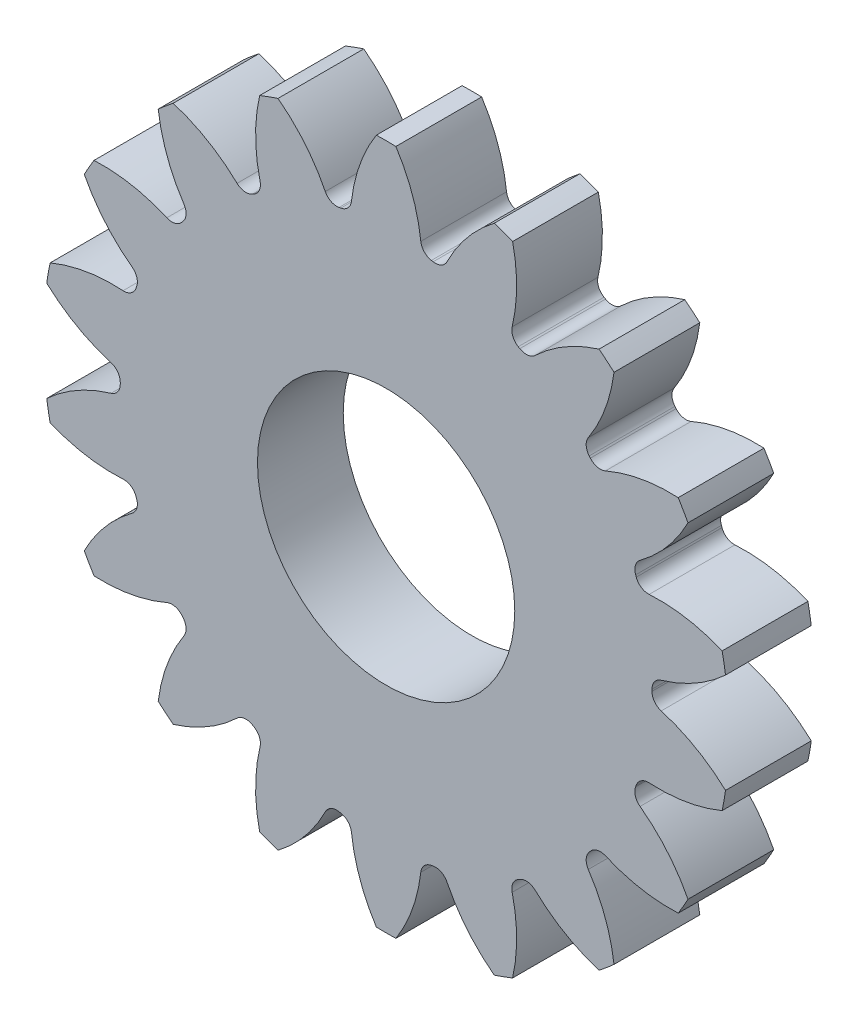
from build123d import *

# Parameters (mm, degrees)
EXTRUDE_1_DEPTH                  = 5
EXTRUDE_2_DEPTH                  = 5
CUT_EXTRUDE_1_REACH              = 27.792
SKETCH_2_R                       = 7.5
FILLET_1_R                       = 0.75
PATTERN_CIRCULAR_2_COUNT         = 18
FILLET_1_OF_PATTERN_CIRCULAR_2_R = 0.75


with BuildPart() as part:
    # 스케치1 → 보스-돌출1 (new body)
    with BuildSketch(Plane.XY):
        with BuildLine():
            ThreePointArc((-2.07, 15.361155555), (-10.202083121, -11.669083083), (15.5, 0))
            ThreePointArc((15.5, 0), (11.669083083, 10.202083121), (2.07, 15.361155555))
            ThreePointArc((2.07, 15.361155555), (0, 15.5), (-2.07, 15.361155555))
        make_face()
    extrude(amount=EXTRUDE_1_DEPTH)

    # 스케치1<3> → 보스-돌출2 (add)
    with BuildSketch(Plane.XY):
        with BuildLine():
            ThreePointArc((-2.07, 15.361155555), (0, 15.5), (2.07, 15.361155555))
            ThreePointArc((2.07, 15.361155555), (1.622355789, 17.774455905), (0.57, 19.99187585))
            ThreePointArc((0.57, 19.99187585), (0, 20), (-0.57, 19.99187585))
            ThreePointArc((-0.57, 19.99187585), (-1.622355789, 17.774455905), (-2.07, 15.361155555))
        make_face()
    extrude_2 = extrude(amount=EXTRUDE_2_DEPTH)

    # 스케치2 → 컷-돌출1 (cut, up to next)
    with BuildSketch(Plane.XY.offset(5), mode=Mode.PRIVATE) as cut_extrude_1_sk1:
        Circle(SKETCH_2_R)
    cut_extrude_1_tool1 = extrude(cut_extrude_1_sk1.sketch, amount=-CUT_EXTRUDE_1_REACH, mode=Mode.PRIVATE) & part.part
    add(cut_extrude_1_tool1.solids().sort_by_distance((0, 0, 5))[0], mode=Mode.SUBTRACT)

    # 필렛1
    fillet_1_edges = [part.edges().sort_by_distance(p)[0] for p in [
        (2.07, 15.361155555, 2.5),
        (-2.07, 15.361155555, 2.5),
    ]]
    fillet(fillet_1_edges, radius=FILLET_1_R)

    # 원형 패턴2: 보스-돌출2 ×18 about axis
    pattern_circular_2_axis = Axis((0, 0, -0.001), (0, 0, 1))
    for i in range(1, PATTERN_CIRCULAR_2_COUNT):
        add(extrude_2.rotate(pattern_circular_2_axis, i * 360 / PATTERN_CIRCULAR_2_COUNT))

    # 필렛1 of 원형 패턴2
    fillet_1_of_pattern_circular_2_edges = [part.edges().sort_by_distance(p)[0] for p in [
        (-3.3086609, 15.142746219, 2.5),
        (-7.19898835, 13.726782826, 2.5),
        (-8.288248464, 13.097898205, 2.5),
        (-11.459672459, 10.436757501, 2.5),
        (-12.268150943, 9.473250364, 2.5),
        (-14.338150943, 5.887905192, 2.5),
        (-14.768333359, 4.705988718, 2.5),
        (-15.487236814, 0.62888462, 2.5),
        (-15.487236814, -0.62888462, 2.5),
        (-14.768333359, -4.705988718, 2.5),
        (-14.338150943, -5.887905192, 2.5),
        (-12.268150943, -9.473250364, 2.5),
        (-11.459672459, -10.436757501, 2.5),
        (-8.288248464, -13.097898205, 2.5),
        (-7.19898835, -13.726782826, 2.5),
        (-3.3086609, -15.142746219, 2.5),
        (-2.07, -15.361155555, 2.5),
        (2.07, -15.361155555, 2.5),
        (3.3086609, -15.142746219, 2.5),
        (7.19898835, -13.726782826, 2.5),
        (8.288248464, -13.097898205, 2.5),
        (11.459672459, -10.436757501, 2.5),
        (12.268150943, -9.473250364, 2.5),
        (14.338150943, -5.887905192, 2.5),
        (14.768333359, -4.705988718, 2.5),
        (15.487236814, -0.62888462, 2.5),
        (15.487236814, 0.62888462, 2.5),
        (14.768333359, 4.705988718, 2.5),
        (14.338150943, 5.887905192, 2.5),
        (12.268150943, 9.473250364, 2.5),
        (11.459672459, 10.436757501, 2.5),
        (8.288248464, 13.097898205, 2.5),
        (7.19898835, 13.726782826, 2.5),
        (3.3086609, 15.142746219, 2.5),
    ]]
    fillet(fillet_1_of_pattern_circular_2_edges, radius=FILLET_1_OF_PATTERN_CIRCULAR_2_R)


solid = part.part
